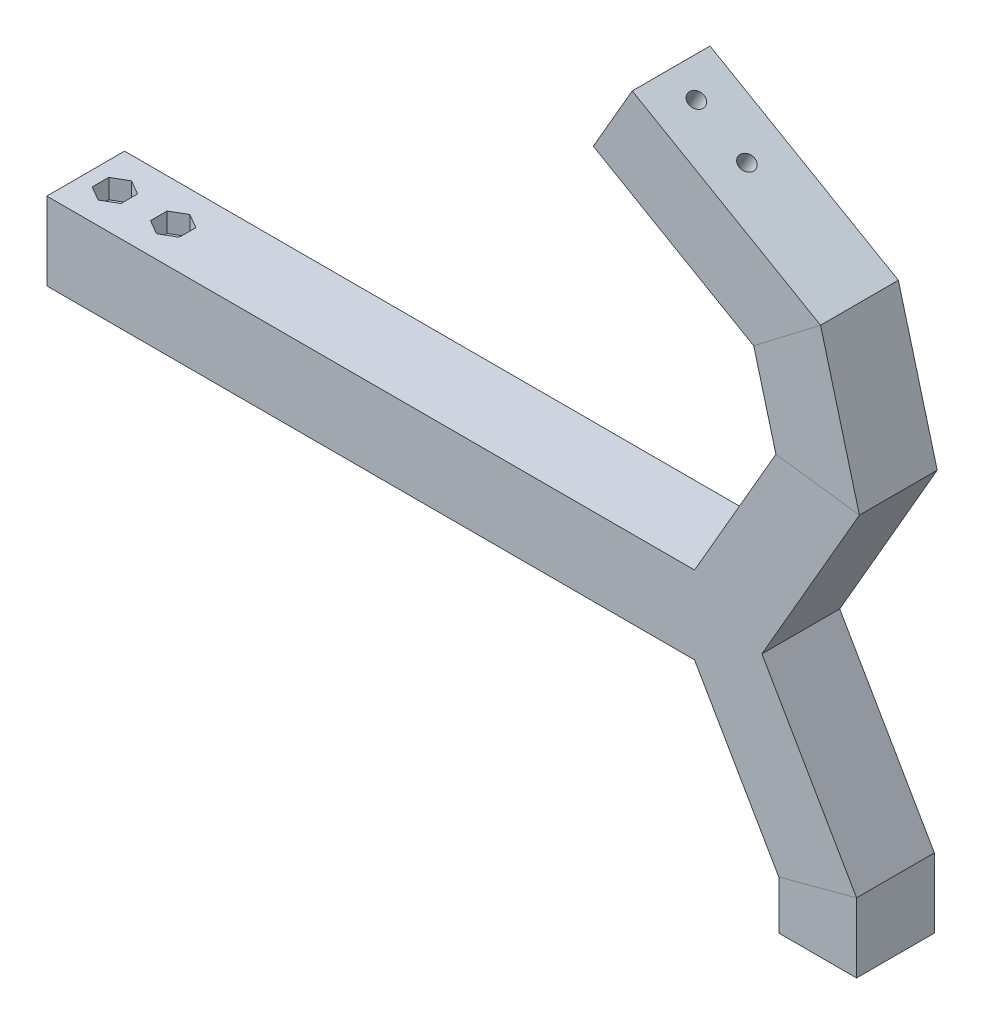
from build123d import *

# Parameters (mm, degrees)
SKETCH2_W          = 20
SKETCH2_H          = 20
SKETCH4_W          = 20
SKETCH4_H          = 20
CUT_EXTRUDE1_REACH = 228.27
SKETCH5_R          = 2
CUT_EXTRUDE2_START = -15
SKETCH5_3_R        = 2
CUT_EXTRUDE2_DEPTH = 5
CUT_EXTRUDE3_REACH = 204.251
SKETCH6_R          = 2
SKETCH6_5_R        = 2
CUT_EXTRUDE4_DEPTH = 5


with BuildPart() as part:
    # Sweep1: sweep along a path in Sketch1
    with BuildLine(Plane.XY) as sweep1_path:
        Line((0, 0), (44.828773608, -25.88190451))
        Line((44.828773608, -25.88190451), (52.676823753, -55.171226392))
        Line((52.676823753, -55.171226392), (26.794919243, -100))
        Line((26.794919243, -100), (52.676823753, -144.828773608))
        Line((52.676823753, -144.828773608), (52.676823753, -160))
    # Sketch2 → Sweep1 (sweep)
    with BuildSketch(Plane(origin=(0, 0, 0), x_dir=(0, 0, 1), z_dir=(-0.8660254037844382, 0.500000000000001, 0))):
        Rectangle(SKETCH2_W, SKETCH2_H)
    sweep(path=sweep1_path.line, transition=Transition.RIGHT)

    # Sweep3: sweep along a path in Sketch1<5>
    with BuildLine(Plane.XY) as sweep3_path:
        Line((26.794919243, -100), (-145.505080757, -100))
    # Sketch4 → Sweep3 (sweep)
    with BuildSketch(Plane(origin=(-145.505080757, -100, 0), x_dir=(0, 0, 1), z_dir=(-1, 0, 0))):
        Rectangle(SKETCH4_W, SKETCH4_H)
    sweep(path=sweep3_path.line)

    # Sketch5 → Cut-Extrude1 (cut, up to next)
    with BuildSketch(Plane(origin=(5, 8.660254038, 0), x_dir=(0.8660254037844382, -0.500000000000001, 0), z_dir=(0.500000000000001, 0.8660254037844382, 0)), mode=Mode.PRIVATE) as cut_extrude1_sk1:
        with Locations(Location((7.5, 0, 0), (0, 0, 180))):
            Circle(SKETCH5_R)
    cut_extrude1_tool1 = extrude(cut_extrude1_sk1.sketch, amount=-CUT_EXTRUDE1_REACH, mode=Mode.PRIVATE) & part.part
    # Sketch5 → Cut-Extrude1 (cut, up to next)
    with BuildSketch(Plane(origin=(5, 8.660254038, 0), x_dir=(0.8660254037844382, -0.500000000000001, 0), z_dir=(0.500000000000001, 0.8660254037844382, 0)), mode=Mode.PRIVATE) as cut_extrude1_sk2:
        with Locations(Location((22.5, 0, 0), (0, 0, 180))):
            Circle(SKETCH5_R)
    cut_extrude1_tool2 = extrude(cut_extrude1_sk2.sketch, amount=-CUT_EXTRUDE1_REACH, mode=Mode.PRIVATE) & part.part
    add(cut_extrude1_tool1.solids().sort_by_distance((11.495191, 4.910254, 0))[0], mode=Mode.SUBTRACT)
    add(cut_extrude1_tool2.solids().sort_by_distance((24.485572, -2.589746, 0))[0], mode=Mode.SUBTRACT)

    # Sketch5<3> → Cut-Extrude2 (cut)
    # profile 1 of 2: a face of its own
    with BuildSketch(Plane(origin=(5, 8.660254038, 0), x_dir=(0.8660254037844382, -0.500000000000001, 0), z_dir=(0.500000000000001, 0.8660254037844382, 0)).offset(CUT_EXTRUDE2_START)):
        Polygon((11.2, -2.136195996), (11.2, 2.136195996), (7.5, 4.272391992), (3.8, 2.136195996), (3.8, -2.136195996), (7.5, -4.272391992), align=None)
        with Locations(Location((7.5, 0, 0), (0, 0, 180))):
            Circle(SKETCH5_3_R, mode=Mode.SUBTRACT)
    # profile 2 of 2: a face of its own
    with BuildSketch(Plane(origin=(5, 8.660254038, 0), x_dir=(0.8660254037844382, -0.500000000000001, 0), z_dir=(0.500000000000001, 0.8660254037844382, 0)).offset(CUT_EXTRUDE2_START)):
        Polygon((26.2, -2.136195996), (26.2, 2.136195996), (22.5, 4.272391992), (18.8, 2.136195996), (18.8, -2.136195996), (22.5, -4.272391992), align=None)
        with Locations(Location((22.5, 0, 0), (0, 0, 180))):
            Circle(SKETCH5_3_R, mode=Mode.SUBTRACT)
    extrude(amount=-CUT_EXTRUDE2_DEPTH, mode=Mode.SUBTRACT)

    # Sketch6 → Cut-Extrude3 (cut, up to next)
    with BuildSketch(Plane(origin=(0, -90, -90), x_dir=(1, 0, 0), z_dir=(0, 1, 0)), mode=Mode.PRIVATE) as cut_extrude3_sk1:
        with Locations(Location((-138.005080757, -90, 0), (0, 0, 180))):
            Circle(SKETCH6_R)
    cut_extrude3_tool1 = extrude(cut_extrude3_sk1.sketch, amount=-CUT_EXTRUDE3_REACH, mode=Mode.PRIVATE) & part.part
    # Sketch6 → Cut-Extrude3 (cut, up to next)
    with BuildSketch(Plane(origin=(0, -90, -90), x_dir=(1, 0, 0), z_dir=(0, 1, 0)), mode=Mode.PRIVATE) as cut_extrude3_sk2:
        with Locations(Location((-123.005080757, -90, 0), (0, 0, 180))):
            Circle(SKETCH6_R)
    cut_extrude3_tool2 = extrude(cut_extrude3_sk2.sketch, amount=-CUT_EXTRUDE3_REACH, mode=Mode.PRIVATE) & part.part
    add(cut_extrude3_tool1.solids().sort_by_distance((-138.005081, -90, 0))[0], mode=Mode.SUBTRACT)
    add(cut_extrude3_tool2.solids().sort_by_distance((-123.005081, -90, 0))[0], mode=Mode.SUBTRACT)

    # Sketch6<5> → Cut-Extrude4 (cut)
    # profile 1 of 2: a face of its own
    with BuildSketch(Plane(origin=(0, -90, -90), x_dir=(1, 0, 0), z_dir=(0, 1, 0))):
        Polygon((-134.305080757, -92.136195996), (-134.305080757, -87.863804004), (-138.005080757, -85.727608008), (-141.705080757, -87.863804004), (-141.705080757, -92.136195996), (-138.005080757, -94.272391992), align=None)
        with Locations(Location((-138.005080757, -90, 0), (0, 0, 180))):
            Circle(SKETCH6_5_R, mode=Mode.SUBTRACT)
    # profile 2 of 2: a face of its own
    with BuildSketch(Plane(origin=(0, -90, -90), x_dir=(1, 0, 0), z_dir=(0, 1, 0))):
        Polygon((-119.305080757, -92.136195996), (-119.305080757, -87.863804004), (-123.005080757, -85.727608008), (-126.705080757, -87.863804004), (-126.705080757, -92.136195996), (-123.005080757, -94.272391992), align=None)
        with Locations(Location((-123.005080757, -90, 0), (0, 0, 180))):
            Circle(SKETCH6_5_R, mode=Mode.SUBTRACT)
    extrude(amount=-CUT_EXTRUDE4_DEPTH, mode=Mode.SUBTRACT)


solid = part.part
